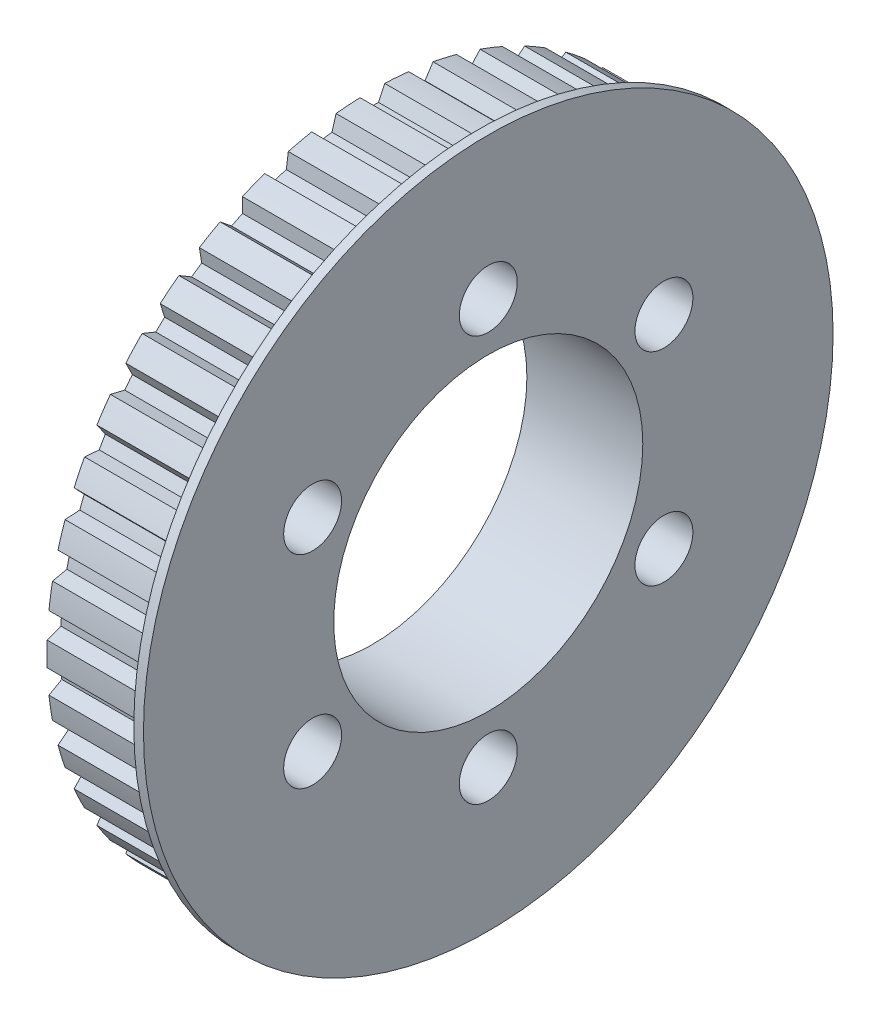
from build123d import *

# Parameters (mm, degrees)
SKETCH1_R           = 33.705
SKETCH1_R_2         = 16
BOSS_EXTRUDE1_DEPTH = 11
CUT_EXTRUDE1_DEPTH  = 49.918851683
SKETCH4_R           = 35.705
SKETCH4_R_2         = 16
BOSS_EXTRUDE2_DEPTH = 1
SKETCH5_R           = 3
CUT_EXTRUDE2_DEPTH  = 52.900809724


with BuildPart() as part:
    # Sketch1 → Boss-Extrude1 (new body)
    with BuildSketch(Plane(origin=(0, 0, 0), x_dir=(0, 0, -1), z_dir=(1, 0, 0))):
        Circle(SKETCH1_R)
        Circle(SKETCH1_R_2, mode=Mode.SUBTRACT)
    extrude(amount=BOSS_EXTRUDE1_DEPTH)

    # Sketch2 → Cut-Extrude1 (cut, through all)
    with BuildSketch(Plane.ZY):
        with BuildLine():
            Line((1.279373326, 33.680710041), (0.63495911, 32.298759294))
            ThreePointArc((0.63495911, 32.298759294), (0, 32.305), (-0.63495911, 32.298759294))
            Line((-0.63495911, 32.298759294), (-1.279373326, 33.680710041))
            ThreePointArc((-1.279373326, 33.680710041), (0, 33.705), (1.279373326, 33.680710041))
        make_face()
        with BuildLine():
            Line((6.284933134, 33.113843638), (5.441747421, 31.843373094))
            ThreePointArc((5.441747421, 31.843373094), (4.814810409, 31.944179841), (4.186013139, 32.032644583))
            Line((4.186013139, 32.032644583), (3.754765568, 33.495205038))
            ThreePointArc((3.754765568, 33.495205038), (5.023469581, 33.328542998), (6.284933134, 33.113843638))
        make_face()
        with BuildLine():
            Line((11.150097922, 31.807268687), (10.126976087, 30.676658559))
            ThreePointArc((10.126976087, 30.676658559), (9.522065909, 30.869779491), (8.913476771, 31.050973525))
            Line((8.913476771, 31.050973525), (8.705029204, 32.561472503))
            ThreePointArc((8.705029204, 32.561472503), (9.934723154, 32.207581419), (11.150097922, 31.807268687))
        make_face()
        with BuildLine():
            Line((15.766187946, 29.790171914), (14.585984841, 28.824678163))
            ThreePointArc((14.585984841, 28.824678163), (14.016614192, 29.105799278), (13.441828061, 29.375675028))
            Line((13.441828061, 29.375675028), (13.460836872, 30.900370479))
            ThreePointArc((13.460836872, 30.900370479), (14.624051427, 30.367155693), (15.766187946, 29.790171914))
        make_face()
        with BuildLine():
            Line((20.030087385, 27.107611926), (18.719166797, 26.328802089))
            ThreePointArc((18.719166797, 26.328802089), (18.198054476, 26.691643604), (17.669911124, 27.044172493))
            Line((17.669911124, 27.044172493), (17.915951687, 28.549005239))
            ThreePointArc((17.915951687, 28.549005239), (18.986702557, 27.848377888), (20.030087385, 27.107611926))
        make_face()
        with BuildLine():
            Line((23.84654777, 23.819512682), (22.434193499, 23.244784082))
            ThreePointArc((22.434193499, 23.244784082), (21.972980294, 23.681240719), (21.503277572, 24.108547834))
            Line((21.503277572, 24.108547834), (21.970853747, 25.559902398))
            ThreePointArc((21.970853747, 25.559902398), (22.925222127, 24.70751334), (23.84654777, 23.819512682))
        make_face()
        with BuildLine():
            Line((27.130315684, 19.999324886), (25.64807739, 19.641516011))
            ThreePointArc((25.64807739, 19.641516011), (25.257066041, 20.141838049), (24.856296331, 20.634378054))
            Line((24.856296331, 20.634378054), (25.534963241, 21.999833574))
            ThreePointArc((25.534963241, 21.999833574), (26.351630117, 21.014723772), (27.130315684, 19.999324886))
        make_face()
        with BuildLine():
            Line((29.808037176, 15.732385219), (28.289025614, 15.599488928))
            ThreePointArc((28.289025614, 15.599488928), (27.976950669, 16.1525), (27.654066505, 16.699270366))
            Line((27.654066505, 16.699270366), (28.52866385, 17.948324822))
            ThreePointArc((28.52866385, 17.948324822), (29.189386235, 16.8525), (29.808037176, 15.732385219))
        make_face()
        with BuildLine():
            Line((31.819896375, 11.114010064), (30.298043752, 11.20899504))
            ThreePointArc((30.298043752, 11.20899504), (30.07187645, 11.802341792), (29.834090529, 12.391128573))
            Line((29.834090529, 12.391128573), (30.885081252, 13.495880152))
            ThreePointArc((30.885081252, 13.495880152), (31.375099698, 12.313819226), (31.819896375, 11.114010064))
        make_face()
        with BuildLine():
            Line((33.120951669, 6.247366289), (31.630253659, 6.568110725))
            ThreePointArc((31.630253659, 6.568110725), (31.495046203, 7.188538771), (31.34767027, 7.806189443))
            Line((31.34767027, 7.806189443), (32.551576974, 8.741959821))
            ThreePointArc((32.551576974, 8.741959821), (32.85994528, 7.500068079), (33.120951669, 6.247366289))
        make_face()
        with BuildLine():
            Line((33.682139633, 1.241166674), (32.255895966, 1.78050567))
            ThreePointArc((32.255895966, 1.78050567), (32.214668668, 2.414155673), (32.160994858, 3.04687294))
            Line((32.160994858, 3.04687294), (33.490924257, 3.792758552))
            ThreePointArc((33.490924257, 3.792758552), (33.610753984, 2.518777804), (33.682139633, 1.241166674))
        make_face()
        with BuildLine():
            Line((33.490924257, -3.792758552), (32.160994858, -3.04687294))
            ThreePointArc((32.160994858, -3.04687294), (32.214668668, -2.414155673), (32.255895966, -1.78050567))
            Line((32.255895966, -1.78050567), (33.682139633, -1.241166674))
            ThreePointArc((33.682139633, -1.241166674), (33.610753984, -2.518777804), (33.490924257, -3.792758552))
        make_face()
        with BuildLine():
            Line((32.551576974, -8.741959821), (31.34767027, -7.806189443))
            ThreePointArc((31.34767027, -7.806189443), (31.495046203, -7.188538771), (31.630253659, -6.568110725))
            Line((31.630253659, -6.568110725), (33.120951669, -6.247366289))
            ThreePointArc((33.120951669, -6.247366289), (32.85994528, -7.500068079), (32.551576974, -8.741959821))
        make_face()
        with BuildLine():
            Line((30.885081252, -13.495880152), (29.834090529, -12.391128573))
            ThreePointArc((29.834090529, -12.391128573), (30.07187645, -11.802341792), (30.298043752, -11.20899504))
            Line((30.298043752, -11.20899504), (31.819896375, -11.114010064))
            ThreePointArc((31.819896375, -11.114010064), (31.375099698, -12.313819226), (30.885081252, -13.495880152))
        make_face()
        with BuildLine():
            Line((28.52866385, -17.948324822), (27.654066505, -16.699270366))
            ThreePointArc((27.654066505, -16.699270366), (27.976950669, -16.1525), (28.289025614, -15.599488928))
            Line((28.289025614, -15.599488928), (29.808037176, -15.732385219))
            ThreePointArc((29.808037176, -15.732385219), (29.189386235, -16.8525), (28.52866385, -17.948324822))
        make_face()
        with BuildLine():
            Line((25.534963241, -21.999833574), (24.856296331, -20.634378054))
            ThreePointArc((24.856296331, -20.634378054), (25.257066041, -20.141838049), (25.64807739, -19.641516011))
            Line((25.64807739, -19.641516011), (27.130315684, -19.999324886))
            ThreePointArc((27.130315684, -19.999324886), (26.351630117, -21.014723772), (25.534963241, -21.999833574))
        make_face()
        with BuildLine():
            Line((21.970853747, -25.559902398), (21.503277572, -24.108547834))
            ThreePointArc((21.503277572, -24.108547834), (21.972980294, -23.681240719), (22.434193499, -23.244784082))
            Line((22.434193499, -23.244784082), (23.84654777, -23.819512682))
            ThreePointArc((23.84654777, -23.819512682), (22.925222127, -24.70751334), (21.970853747, -25.559902398))
        make_face()
        with BuildLine():
            Line((17.915951687, -28.549005239), (17.669911124, -27.044172493))
            ThreePointArc((17.669911124, -27.044172493), (18.198054476, -26.691643604), (18.719166797, -26.328802089))
            Line((18.719166797, -26.328802089), (20.030087385, -27.107611926))
            ThreePointArc((20.030087385, -27.107611926), (18.986702557, -27.848377888), (17.915951687, -28.549005239))
        make_face()
        with BuildLine():
            Line((13.460836872, -30.900370479), (13.441828061, -29.375675028))
            ThreePointArc((13.441828061, -29.375675028), (14.016614192, -29.105799278), (14.585984841, -28.824678163))
            Line((14.585984841, -28.824678163), (15.766187946, -29.790171914))
            ThreePointArc((15.766187946, -29.790171914), (14.624051427, -30.367155693), (13.460836872, -30.900370479))
        make_face()
        with BuildLine():
            Line((8.705029204, -32.561472503), (8.913476771, -31.050973525))
            ThreePointArc((8.913476771, -31.050973525), (9.522065909, -30.869779491), (10.126976087, -30.676658559))
            Line((10.126976087, -30.676658559), (11.150097922, -31.807268687))
            ThreePointArc((11.150097922, -31.807268687), (9.934723154, -32.207581419), (8.705029204, -32.561472503))
        make_face()
        with BuildLine():
            Line((3.754765568, -33.495205038), (4.186013139, -32.032644583))
            ThreePointArc((4.186013139, -32.032644583), (4.814810409, -31.944179841), (5.441747421, -31.843373094))
            Line((5.441747421, -31.843373094), (6.284933134, -33.113843638))
            ThreePointArc((6.284933134, -33.113843638), (5.023469581, -33.328542998), (3.754765568, -33.495205038))
        make_face()
        with BuildLine():
            Line((-1.279373326, -33.680710041), (-0.63495911, -32.298759294))
            ThreePointArc((-0.63495911, -32.298759294), (0, -32.305), (0.63495911, -32.298759294))
            Line((0.63495911, -32.298759294), (1.279373326, -33.680710041))
            ThreePointArc((1.279373326, -33.680710041), (0, -33.705), (-1.279373326, -33.680710041))
        make_face()
        with BuildLine():
            Line((-6.284933134, -33.113843638), (-5.441747421, -31.843373094))
            ThreePointArc((-5.441747421, -31.843373094), (-4.814810409, -31.944179841), (-4.186013139, -32.032644583))
            Line((-4.186013139, -32.032644583), (-3.754765568, -33.495205038))
            ThreePointArc((-3.754765568, -33.495205038), (-5.023469581, -33.328542998), (-6.284933134, -33.113843638))
        make_face()
        with BuildLine():
            Line((-11.150097922, -31.807268687), (-10.126976087, -30.676658559))
            ThreePointArc((-10.126976087, -30.676658559), (-9.522065909, -30.869779491), (-8.913476771, -31.050973525))
            Line((-8.913476771, -31.050973525), (-8.705029204, -32.561472503))
            ThreePointArc((-8.705029204, -32.561472503), (-9.934723154, -32.207581419), (-11.150097922, -31.807268687))
        make_face()
        with BuildLine():
            Line((-15.766187946, -29.790171914), (-14.585984841, -28.824678163))
            ThreePointArc((-14.585984841, -28.824678163), (-14.016614192, -29.105799278), (-13.441828061, -29.375675028))
            Line((-13.441828061, -29.375675028), (-13.460836872, -30.900370479))
            ThreePointArc((-13.460836872, -30.900370479), (-14.624051427, -30.367155693), (-15.766187946, -29.790171914))
        make_face()
        with BuildLine():
            Line((-20.030087385, -27.107611926), (-18.719166797, -26.328802089))
            ThreePointArc((-18.719166797, -26.328802089), (-18.198054476, -26.691643604), (-17.669911124, -27.044172493))
            Line((-17.669911124, -27.044172493), (-17.915951687, -28.549005239))
            ThreePointArc((-17.915951687, -28.549005239), (-18.986702557, -27.848377888), (-20.030087385, -27.107611926))
        make_face()
        with BuildLine():
            Line((-23.84654777, -23.819512682), (-22.434193499, -23.244784082))
            ThreePointArc((-22.434193499, -23.244784082), (-21.972980294, -23.681240719), (-21.503277572, -24.108547834))
            Line((-21.503277572, -24.108547834), (-21.970853747, -25.559902398))
            ThreePointArc((-21.970853747, -25.559902398), (-22.925222127, -24.70751334), (-23.84654777, -23.819512682))
        make_face()
        with BuildLine():
            Line((-27.130315684, -19.999324886), (-25.64807739, -19.641516011))
            ThreePointArc((-25.64807739, -19.641516011), (-25.257066041, -20.141838049), (-24.856296331, -20.634378054))
            Line((-24.856296331, -20.634378054), (-25.534963241, -21.999833574))
            ThreePointArc((-25.534963241, -21.999833574), (-26.351630117, -21.014723772), (-27.130315684, -19.999324886))
        make_face()
        with BuildLine():
            Line((-29.808037176, -15.732385219), (-28.289025614, -15.599488928))
            ThreePointArc((-28.289025614, -15.599488928), (-27.976950669, -16.1525), (-27.654066505, -16.699270366))
            Line((-27.654066505, -16.699270366), (-28.52866385, -17.948324822))
            ThreePointArc((-28.52866385, -17.948324822), (-29.189386235, -16.8525), (-29.808037176, -15.732385219))
        make_face()
        with BuildLine():
            Line((-31.819896375, -11.114010064), (-30.298043752, -11.20899504))
            ThreePointArc((-30.298043752, -11.20899504), (-30.07187645, -11.802341792), (-29.834090529, -12.391128573))
            Line((-29.834090529, -12.391128573), (-30.885081252, -13.495880152))
            ThreePointArc((-30.885081252, -13.495880152), (-31.375099698, -12.313819226), (-31.819896375, -11.114010064))
        make_face()
        with BuildLine():
            Line((-33.120951669, -6.247366289), (-31.630253659, -6.568110725))
            ThreePointArc((-31.630253659, -6.568110725), (-31.495046203, -7.188538771), (-31.34767027, -7.806189443))
            Line((-31.34767027, -7.806189443), (-32.551576974, -8.741959821))
            ThreePointArc((-32.551576974, -8.741959821), (-32.85994528, -7.500068079), (-33.120951669, -6.247366289))
        make_face()
        with BuildLine():
            Line((-33.682139633, -1.241166674), (-32.255895966, -1.78050567))
            ThreePointArc((-32.255895966, -1.78050567), (-32.214668668, -2.414155673), (-32.160994858, -3.04687294))
            Line((-32.160994858, -3.04687294), (-33.490924257, -3.792758552))
            ThreePointArc((-33.490924257, -3.792758552), (-33.610753984, -2.518777804), (-33.682139633, -1.241166674))
        make_face()
        with BuildLine():
            Line((-33.490924257, 3.792758552), (-32.160994858, 3.04687294))
            ThreePointArc((-32.160994858, 3.04687294), (-32.214668668, 2.414155673), (-32.255895966, 1.78050567))
            Line((-32.255895966, 1.78050567), (-33.682139633, 1.241166674))
            ThreePointArc((-33.682139633, 1.241166674), (-33.610753984, 2.518777804), (-33.490924257, 3.792758552))
        make_face()
        with BuildLine():
            Line((-32.551576974, 8.741959821), (-31.34767027, 7.806189443))
            ThreePointArc((-31.34767027, 7.806189443), (-31.495046203, 7.188538771), (-31.630253659, 6.568110725))
            Line((-31.630253659, 6.568110725), (-33.120951669, 6.247366289))
            ThreePointArc((-33.120951669, 6.247366289), (-32.85994528, 7.500068079), (-32.551576974, 8.741959821))
        make_face()
        with BuildLine():
            Line((-30.885081252, 13.495880152), (-29.834090529, 12.391128573))
            ThreePointArc((-29.834090529, 12.391128573), (-30.07187645, 11.802341792), (-30.298043752, 11.20899504))
            Line((-30.298043752, 11.20899504), (-31.819896375, 11.114010064))
            ThreePointArc((-31.819896375, 11.114010064), (-31.375099698, 12.313819226), (-30.885081252, 13.495880152))
        make_face()
        with BuildLine():
            Line((-28.52866385, 17.948324822), (-27.654066505, 16.699270366))
            ThreePointArc((-27.654066505, 16.699270366), (-27.976950669, 16.1525), (-28.289025614, 15.599488928))
            Line((-28.289025614, 15.599488928), (-29.808037176, 15.732385219))
            ThreePointArc((-29.808037176, 15.732385219), (-29.189386235, 16.8525), (-28.52866385, 17.948324822))
        make_face()
        with BuildLine():
            Line((-25.534963241, 21.999833574), (-24.856296331, 20.634378054))
            ThreePointArc((-24.856296331, 20.634378054), (-25.257066041, 20.141838049), (-25.64807739, 19.641516011))
            Line((-25.64807739, 19.641516011), (-27.130315684, 19.999324886))
            ThreePointArc((-27.130315684, 19.999324886), (-26.351630117, 21.014723772), (-25.534963241, 21.999833574))
        make_face()
        with BuildLine():
            Line((-21.970853747, 25.559902398), (-21.503277572, 24.108547834))
            ThreePointArc((-21.503277572, 24.108547834), (-21.972980294, 23.681240719), (-22.434193499, 23.244784082))
            Line((-22.434193499, 23.244784082), (-23.84654777, 23.819512682))
            ThreePointArc((-23.84654777, 23.819512682), (-22.925222127, 24.70751334), (-21.970853747, 25.559902398))
        make_face()
        with BuildLine():
            Line((-17.915951687, 28.549005239), (-17.669911124, 27.044172493))
            ThreePointArc((-17.669911124, 27.044172493), (-18.198054476, 26.691643604), (-18.719166797, 26.328802089))
            Line((-18.719166797, 26.328802089), (-20.030087385, 27.107611926))
            ThreePointArc((-20.030087385, 27.107611926), (-18.986702557, 27.848377888), (-17.915951687, 28.549005239))
        make_face()
        with BuildLine():
            Line((-13.460836872, 30.900370479), (-13.441828061, 29.375675028))
            ThreePointArc((-13.441828061, 29.375675028), (-14.016614192, 29.105799278), (-14.585984841, 28.824678163))
            Line((-14.585984841, 28.824678163), (-15.766187946, 29.790171914))
            ThreePointArc((-15.766187946, 29.790171914), (-14.624051427, 30.367155693), (-13.460836872, 30.900370479))
        make_face()
        with BuildLine():
            Line((-8.705029204, 32.561472503), (-8.913476771, 31.050973525))
            ThreePointArc((-8.913476771, 31.050973525), (-9.522065909, 30.869779491), (-10.126976087, 30.676658559))
            Line((-10.126976087, 30.676658559), (-11.150097922, 31.807268687))
            ThreePointArc((-11.150097922, 31.807268687), (-9.934723154, 32.207581419), (-8.705029204, 32.561472503))
        make_face()
        with BuildLine():
            Line((-3.754765568, 33.495205038), (-4.186013139, 32.032644583))
            ThreePointArc((-4.186013139, 32.032644583), (-4.814810409, 31.944179841), (-5.441747421, 31.843373094))
            Line((-5.441747421, 31.843373094), (-6.284933134, 33.113843638))
            ThreePointArc((-6.284933134, 33.113843638), (-5.023469581, 33.328542998), (-3.754765568, 33.495205038))
        make_face()
    extrude(amount=-CUT_EXTRUDE1_DEPTH, mode=Mode.SUBTRACT)

    # Sketch4 → Boss-Extrude2 (add)
    with BuildSketch(Plane(origin=(11, 0, 0), x_dir=(0, 0, -1), z_dir=(1, 0, 0))):
        Circle(SKETCH4_R)
        Circle(SKETCH4_R_2, mode=Mode.SUBTRACT)
    extrude(amount=BOSS_EXTRUDE2_DEPTH)

    # Sketch5 → Cut-Extrude2 (cut, through all)
    with BuildSketch(Plane.ZY):
        with Locations((0, -21)):
            Circle(SKETCH5_R)
        with Locations((-18.186533479, -10.5)):
            Circle(SKETCH5_R)
        with Locations((-18.186533479, 10.5)):
            Circle(SKETCH5_R)
        with Locations((0, 21)):
            Circle(SKETCH5_R)
        with Locations((18.186533479, 10.5)):
            Circle(SKETCH5_R)
        with Locations((18.186533479, -10.5)):
            Circle(SKETCH5_R)
    extrude(amount=-CUT_EXTRUDE2_DEPTH, mode=Mode.SUBTRACT)


solid = part.part
